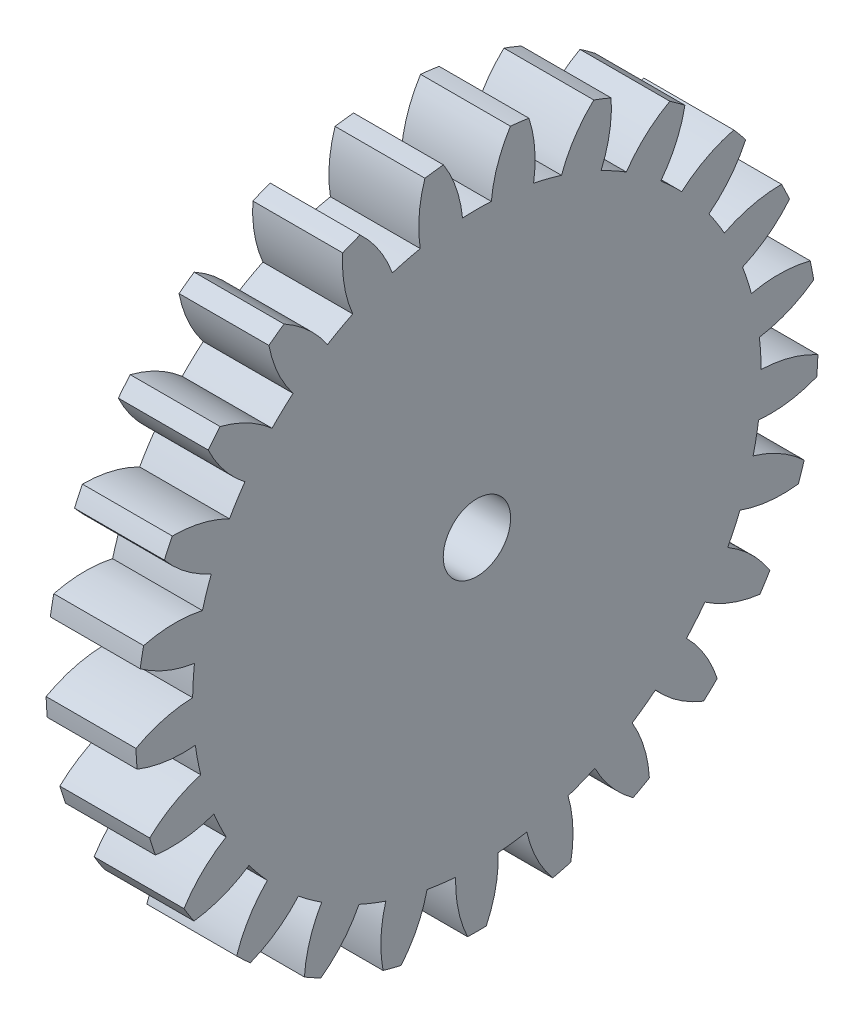
from build123d import *

# Parameters (mm, degrees)
BASPROSKE_W     = 4
BASPROSKE_H     = 15.1875
TOOTHCUT_DEPTH  = 22.847661488
TEETHCUTS_COUNT = 25
TEETHCUTS_ANGLE = 345.6
BORSKE_R        = 1.5
BORE_DEPTH      = 50.0000508


with BuildPart() as part:
    # BasProSke → Base-Revolve (revolve)
    with BuildSketch(Plane(origin=(0, 0, 0), x_dir=(1, 0, 0), z_dir=(0, 1, 0)), mode=Mode.PRIVATE) as base_revolve_sk:
        with Locations((2, 7.59375)):
            Rectangle(BASPROSKE_W, BASPROSKE_H)
    revolve(base_revolve_sk.sketch.rotate(Axis((-10, 0, 0), (1, 0, 0)), 180), axis=Axis((-10, 0, 0), (1, 0, 0)))

    # TooCutSke → ToothCut (cut, through all)
    with BuildSketch(Plane(origin=(0, 0, 0), x_dir=(0, 0, -1), z_dir=(1, 0, 0))):
        with BuildLine():
            ThreePointArc((0.640990962, 12.639006415), (0, 12.65525), (-0.640990962, 12.639006415))
            ThreePointArc((-0.640990962, 12.639006415), (-0.924536263, 13.940148593), (-1.506006128, 15.138172675))
            ThreePointArc((-1.506006128, 15.138172675), (0, 15.2129), (1.506006128, 15.138172675))
            ThreePointArc((1.506006128, 15.138172675), (0.924536263, 13.940148593), (0.640990962, 12.639006415))
        make_face()
    toothcut = extrude(amount=TOOTHCUT_DEPTH, mode=Mode.SUBTRACT)

    # TeethCuts: ToothCut ×25 about axis
    teethcuts_axis = Axis((-10, 0, 0), (1, 0, 0))
    for i in range(1, TEETHCUTS_COUNT):
        add(toothcut.rotate(teethcuts_axis, i * TEETHCUTS_ANGLE / (TEETHCUTS_COUNT - 1)), mode=Mode.SUBTRACT)

    # BorSke → Bore (cut, symmetric)
    with BuildSketch(Plane(origin=(0, 0, 0), x_dir=(0, 0, -1), z_dir=(1, 0, 0))):
        with Locations(Location((0, 0, 0), (0, 0, 180))):
            Circle(BORSKE_R)
    extrude(amount=BORE_DEPTH, both=True, mode=Mode.SUBTRACT)


solid = part.part
